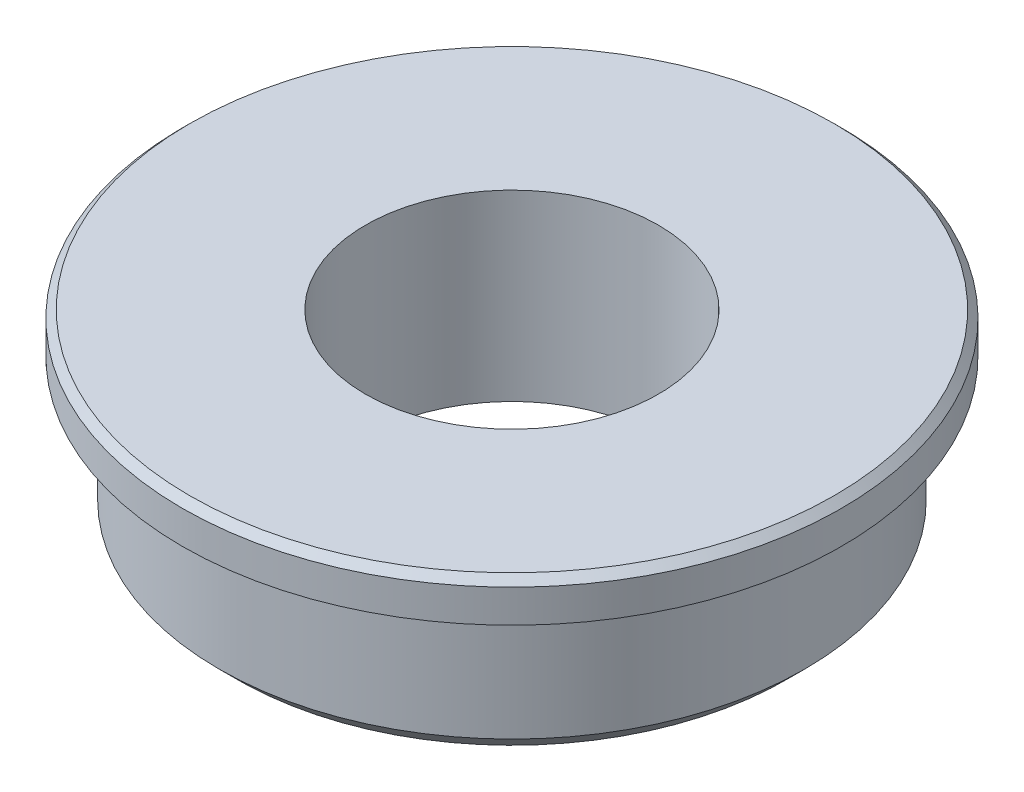
from build123d import *

# Parameters (mm, degrees)
CHAMFER_1_SIZE = 0.5
CHAMFER_2_SIZE = 0.2


with BuildPart() as part:
    # 草图1 → 旋转1 (revolve)
    with BuildSketch(Plane.XY, mode=Mode.PRIVATE) as revolve_1_sk:
        Polygon((-4, 0), (-8, 0), (-8, 3.9), (-9, 3.9), (-9, 5), (-4, 5), align=None)
    revolve(revolve_1_sk.sketch.rotate(Axis((0, 10.75638676, 0), (0, -1, 0)), 270), axis=Axis((0, 10.75638676, 0), (0, -1, 0)))

    # 倒角1
    chamfer_1_edges = [part.edges().sort_by_distance(p)[0] for p in [
        (0, 0, -8),
    ]]
    chamfer(chamfer_1_edges, length=CHAMFER_1_SIZE)

    # 倒角2
    chamfer_2_edges = [part.edges().sort_by_distance(p)[0] for p in [
        (0, 5, -9),
    ]]
    chamfer(chamfer_2_edges, length=CHAMFER_2_SIZE)


solid = part.part
